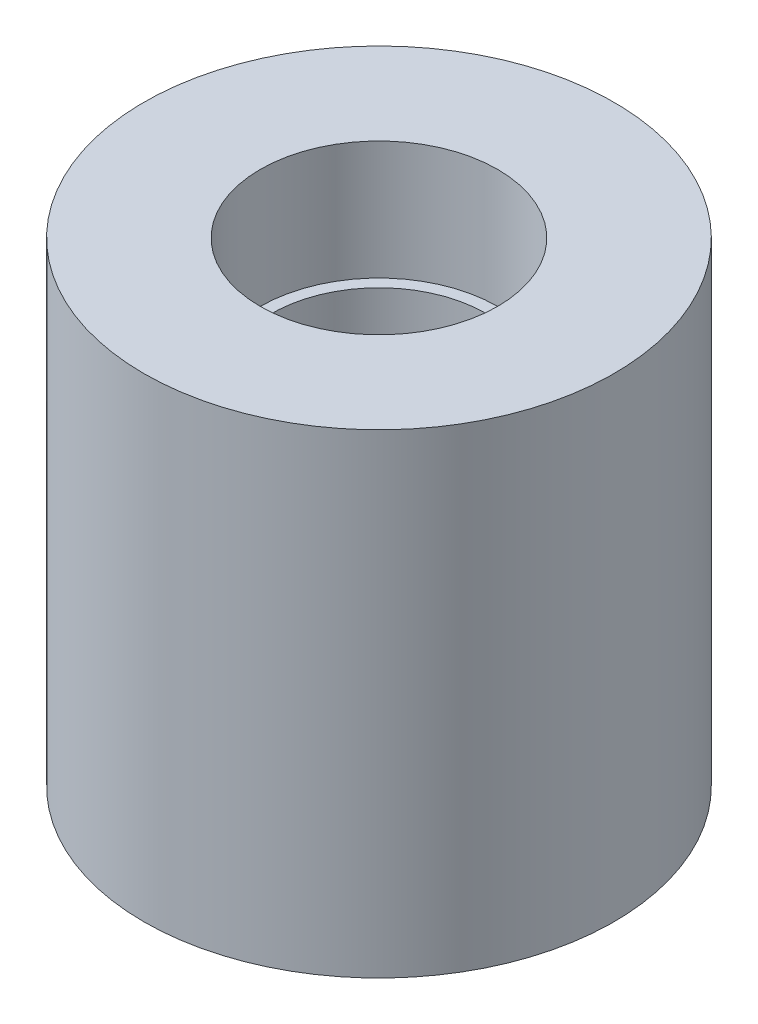
from build123d import *

# Parameters (mm, degrees)
SKETCH1_R           = 12.573
SKETCH1_R_2         = 5.715
BOSS_EXTRUDE1_DEPTH = 25.4
CUT_EXTRUDE2_START  = -6.35
SKETCH3_R           = 6.35
SKETCH3_R_2         = 5.715
CUT_EXTRUDE2_DEPTH  = 6.35
SKETCH4_R           = 6.35
SKETCH4_R_2         = 5.715
CUT_EXTRUDE3_DEPTH  = 6.35


with BuildPart() as part:
    # Sketch1 → Boss-Extrude1 (new body)
    with BuildSketch(Plane(origin=(0, 0, 0), x_dir=(1, 0, 0), z_dir=(0, 1, 0))):
        with Locations(Location((0, 0, 0), (0, 0, 270))):
            Circle(SKETCH1_R)
        with Locations(Location((0, 0, 0), (0, 0, 270))):
            Circle(SKETCH1_R_2, mode=Mode.SUBTRACT)
    extrude(amount=BOSS_EXTRUDE1_DEPTH)

    # Sketch3 → Cut-Extrude2 (cut)
    with BuildSketch(Plane(origin=(0, 25.4, 0), x_dir=(1, 0, 0), z_dir=(0, 1, 0)).offset(CUT_EXTRUDE2_START)):
        with Locations(Location((0, 0, 0), (0, 0, 270))):
            Circle(SKETCH3_R)
        with Locations(Location((0, 0, 0), (0, 0, 270))):
            Circle(SKETCH3_R_2, mode=Mode.SUBTRACT)
    extrude(amount=CUT_EXTRUDE2_DEPTH, mode=Mode.SUBTRACT)

    # Sketch4 → Cut-Extrude3 (cut)
    with BuildSketch(Plane.XZ):
        with Locations(Location((0, 0, 0), (0, 0, 90))):
            Circle(SKETCH4_R)
        with Locations(Location((0, 0, 0), (0, 0, 270))):
            Circle(SKETCH4_R_2, mode=Mode.SUBTRACT)
    extrude(amount=-CUT_EXTRUDE3_DEPTH, mode=Mode.SUBTRACT)


solid = part.part
